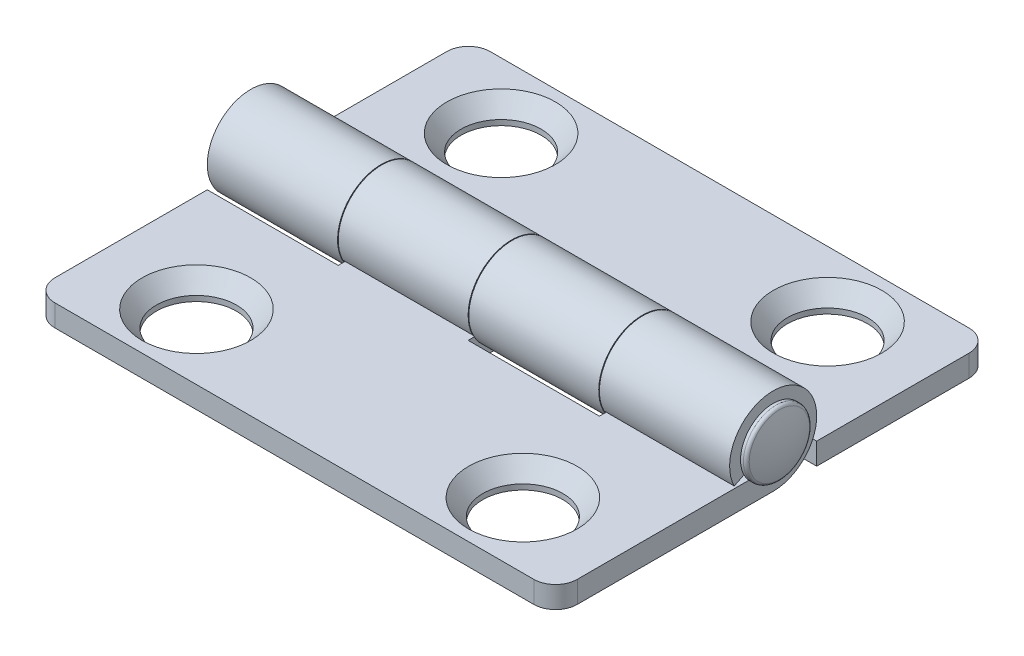
from build123d import *

# Parameters (mm, degrees)
BOSS_EXTRUDE1_DEPTH     = 19.05
SKETCH4_W               = 9.525
SKETCH4_H               = 6.35
CUT_EXTRUDE1_DEPTH      = 25.999975
LPATTERN1_COUNT         = 2
LPATTERN1_PITCH         = 19.05
CUT_EXTRUDE2_DEPTH      = 26.250733281
CUT_EXTRUDE2_DEPTH_BACK = 26.250733281
SKETCH5_W               = 0.0254
SKETCH5_H               = 6.35
SKETCH6_R               = 2.921
CUT_EXTRUDE3_DEPTH      = 26.250733281
FILLET1_R               = 1.5875
CIRPATTERN1_COUNT       = 2
SKETCH8_R               = 1.5875
BOSS_EXTRUDE2_DEPTH     = 19.05


with BuildPart() as part:
    # Sketch3 → Boss-Extrude1 (new, symmetric)
    with BuildSketch(Plane(origin=(0, 0, 0), x_dir=(0, 0, -1), z_dir=(1, 0, 0))):
        with BuildLine():
            Line((0, -3.175), (-15.875, -3.175))
            Line((-15.875, -3.175), (-15.875, -1.5875))
            Line((-15.875, -1.5875), (0, -1.5875))
            ThreePointArc((0, -1.5875), (0.83459814, 1.350408158), (-1.419903166, -0.709951583))
            Line((-1.419903166, -0.709951583), (-2.839806331, -1.419903166))
            ThreePointArc((-2.839806331, -1.419903166), (1.669196281, 2.700816317), (0, -3.175))
        make_face()
    extrude(amount=BOSS_EXTRUDE1_DEPTH, both=True)

    # Sketch4 → Cut-Extrude1 (cut, symmetric)
    with BuildSketch(Plane(origin=(0, 0, 0), x_dir=(1, 0, 0), z_dir=(0, 1, 0))):
        with Locations((4.7625, 0)):
            Rectangle(SKETCH4_W, SKETCH4_H)
    cut_extrude1 = extrude(amount=CUT_EXTRUDE1_DEPTH, both=True, mode=Mode.SUBTRACT)

    # LPattern1: Cut-Extrude1 ×2
    with Locations(*[(-i * LPATTERN1_PITCH, 0, 0) for i in range(1, LPATTERN1_COUNT)]):
        add(cut_extrude1, mode=Mode.SUBTRACT)

    # Sketch5 → Cut-Extrude2 (cut, two sides: drawn at the far end of the back side and taken through both)
    with BuildSketch(Plane(origin=(0, -1.5875, 0), x_dir=(1, 0, 0), z_dir=(0, 1, 0)).offset(-CUT_EXTRUDE2_DEPTH_BACK)):
        with Locations((-9.5123, 0)):
            Rectangle(SKETCH5_W, SKETCH5_H)
        with Locations((-0.0127, 0)):
            Rectangle(SKETCH5_W, SKETCH5_H)
        with Locations((9.5377, 0)):
            Rectangle(SKETCH5_W, SKETCH5_H)
    extrude(amount=CUT_EXTRUDE2_DEPTH + CUT_EXTRUDE2_DEPTH_BACK, mode=Mode.SUBTRACT)

    # Sketch6 → Cut-Extrude3 (cut, through all)
    with BuildSketch(Plane(origin=(0, -1.5875, 0), x_dir=(1, 0, 0), z_dir=(0, 1, 0))):
        with Locations(Location((11.90625, -11.1125, 0), (0, 0, 270))):
            Circle(SKETCH6_R)
        with Locations(Location((-11.90625, -11.1125, 0), (0, 0, 270))):
            Circle(SKETCH6_R)
    extrude(amount=-CUT_EXTRUDE3_DEPTH, mode=Mode.SUBTRACT)

    # Cut-Extrude4 cone 1 section (through the dimple's axis) → Cut-Extrude4 (revolve, cut)
    with BuildSketch(Plane(origin=(-11.90625, -1.5875, 11.1125), x_dir=(0, 0, 1), z_dir=(1, 0, 0))):
        Polygon((0, 0), (3.9624, 0), (0, 4.558219777), align=None)
    revolve(axis=Axis((-11.90625, -1.5875, 11.1125), (0, -1, 0)), mode=Mode.SUBTRACT)

    # Cut-Extrude4 cone 2 section (through the dimple's axis) → Cut-Extrude4 cone 2 (revolve, cut)
    with BuildSketch(Plane(origin=(11.90625, -1.5875, 11.1125), x_dir=(0, 0, 1), z_dir=(1, 0, 0))):
        Polygon((0, 0), (3.9624, 0), (0, 4.558219777), align=None)
    revolve(axis=Axis((11.90625, -1.5875, 11.1125), (0, -1, 0)), mode=Mode.SUBTRACT)

    # Fillet1
    fillet1_edges = [part.edges().sort_by_distance(p)[0] for p in [
        (19.05, -2.38125, 15.875),
        (-19.05, -2.38125, 15.875),
    ]]
    fillet(fillet1_edges, radius=FILLET1_R)


with BuildPart() as cirpattern1_1:
    # CirPattern1: pattern copy
    add(part.part.rotate(Axis((0, 0, 0), (0, 1, 0)), 1 * 360 / CIRPATTERN1_COUNT))


with BuildPart() as body_3:
    # Sketch8 → Boss-Extrude2 (new, symmetric)
    with BuildSketch(Plane(origin=(0, 0, 0), x_dir=(0, 0, -1), z_dir=(1, 0, 0))):
        with Locations(Location((0, 0, 0), (0, 0, 180))):
            Circle(SKETCH8_R)
    extrude(amount=BOSS_EXTRUDE2_DEPTH, both=True)

    # Sketch9 → Revolve1 (revolve)
    with BuildSketch(Plane.XY, mode=Mode.PRIVATE) as revolve1_sk:
        with BuildLine():
            ThreePointArc((-19.263012749, 2.38125), (-19.413269156, 2.332040167), (-19.505304359, 2.203478443))
            ThreePointArc((-19.505304359, 2.203478443), (-19.758645358, 1.114659444), (-19.84375, 0))
            Line((-19.84375, 0), (-19.05, 0))
            Line((-19.05, 0), (-19.05, 2.38125))
            Line((-19.05, 2.38125), (-19.263012749, 2.38125))
        make_face()
        with BuildLine():
            Line((19.05, 2.38125), (19.05, 0))
            Line((19.05, 0), (19.84375, 0))
            ThreePointArc((19.84375, 0), (19.758645358, 1.114659444), (19.505304359, 2.203478443))
            ThreePointArc((19.505304359, 2.203478443), (19.413269156, 2.332040167), (19.263012749, 2.38125))
            Line((19.263012749, 2.38125), (19.05, 2.38125))
        make_face()
    revolve(revolve1_sk.sketch.rotate(Axis((-19.05, 0, 0), (1, 0, 0)), 90), axis=Axis((-19.05, 0, 0), (1, 0, 0)))


solid = Compound([part.part, cirpattern1_1.part, body_3.part])
